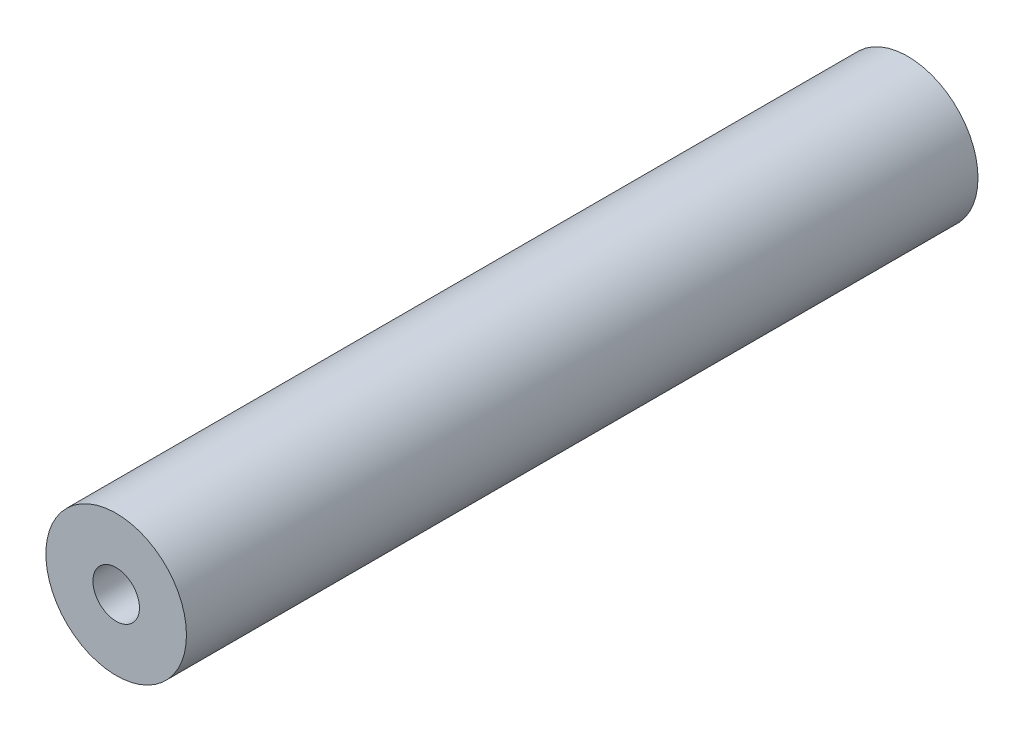
from build123d import *

# Parameters (mm, degrees)
SKETCH1_R           = 6.35
BOSS_EXTRUDE1_DEPTH = 71.5
SKETCH2_R           = 2.1
CUT_EXTRUDE1_DEPTH  = 15


with BuildPart() as part:
    # Sketch1 → Boss-Extrude1 (new body)
    with BuildSketch(Plane.XY):
        Circle(SKETCH1_R)
    extrude(amount=-BOSS_EXTRUDE1_DEPTH)

    # Sketch2 → Cut-Extrude1 (cut)
    with BuildSketch(Plane.XY):
        Circle(SKETCH2_R)
    extrude(amount=-CUT_EXTRUDE1_DEPTH, mode=Mode.SUBTRACT)


solid = part.part
